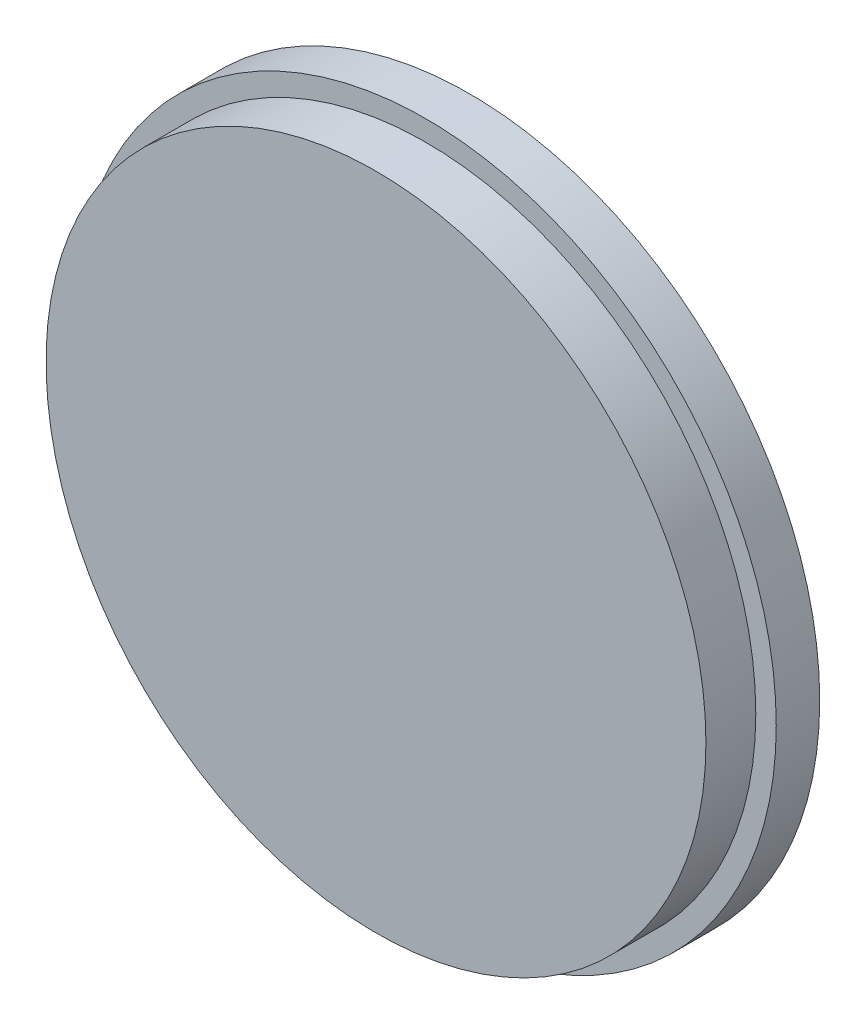
from build123d import *

# Parameters (mm, degrees)
SKETCH_1_R      = 27.4
EXTRUDE_1_DEPTH = 3.4
SKETCH_2_R      = 25.8
EXTRUDE_2_DEPTH = 3.9


with BuildPart() as part:
    # 草图1 → 凸台-拉伸1 (new body)
    with BuildSketch(Plane.XY):
        Circle(SKETCH_1_R)
    extrude(amount=-EXTRUDE_1_DEPTH)

    # 草图2 → 凸台-拉伸2 (add)
    with BuildSketch(Plane.XY):
        Circle(SKETCH_2_R)
    extrude(amount=EXTRUDE_2_DEPTH)


solid = part.part
